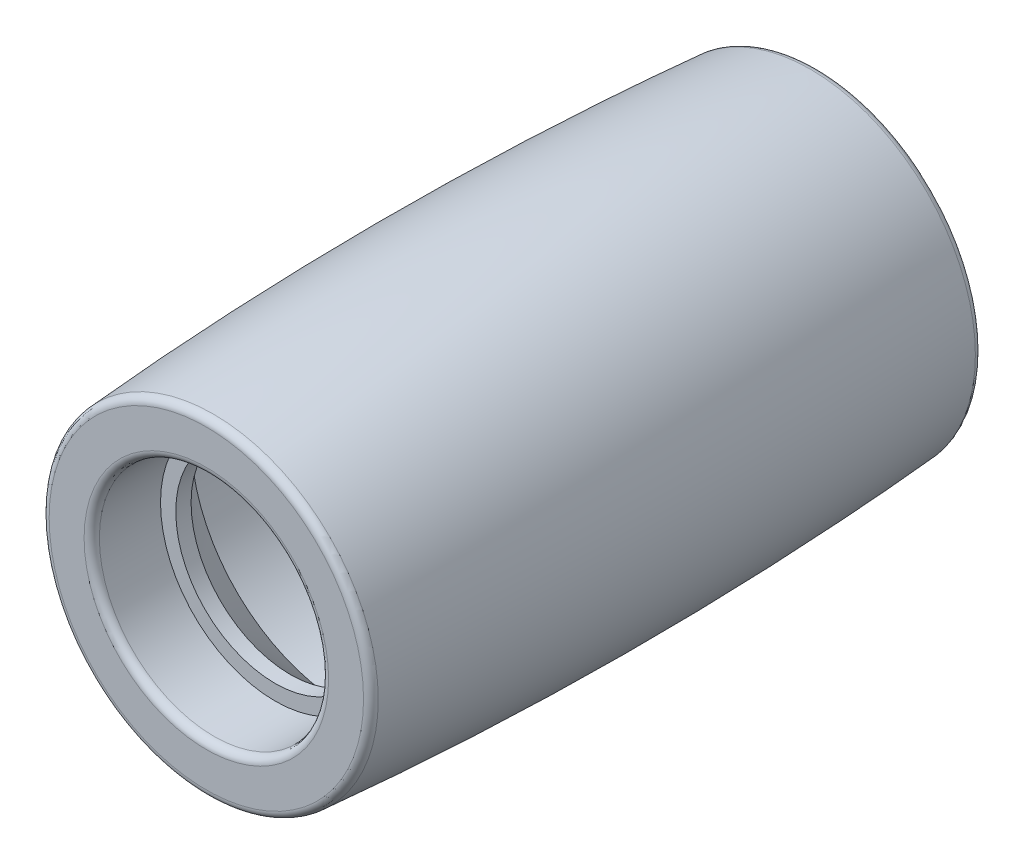
from build123d import *

# Parameters (mm, degrees)
VERRUNDUNG1_R = 1


with BuildPart() as part:
    # Skizze1 → Rotation1 (revolve)
    with BuildSketch(Plane(origin=(450, 0, 0), x_dir=(0, 0, -1), z_dir=(1, 0, 0)), mode=Mode.PRIVATE) as rotation1_sk:
        with BuildLine():
            Line((27.712088496, 20.212088496), (49.5, 20.212088496))
            Line((49.5, 20.212088496), (49.5, 23))
            ThreePointArc((49.5, 23), (29.48594244, 22.624868257), (9.5, 21.5))
            Line((9.5, 21.5), (9.5, 15))
            Line((9.5, 15), (18.5, 15))
            Line((18.5, 15), (18.5, 13))
            Line((18.5, 13), (20.5, 13))
            Line((20.5, 13), (27.712088496, 20.212088496))
        make_face()
    revolve(rotation1_sk.sketch.rotate(Axis((450, 0, 0), (0, 0, -1)), 90), axis=Axis((450, 0, 0), (0, 0, -1)))

    # Spiegeln1: part across plane


with BuildPart() as part_1:
    add(part.part)
    add(part.part.mirror(Plane(origin=(450, 23, -49.5), x_dir=(1, 0, 0), z_dir=(0, 0, 1))))

    # Verrundung1
    verrundung1_edges = [part_1.edges().sort_by_distance(p)[0] for p in [
        (428.5, 0, -89.5),
        (435, 0, -89.5),
        (435, 0, -9.5),
        (428.5, 0, -9.5),
    ]]
    fillet(verrundung1_edges, radius=VERRUNDUNG1_R)


solid = part_1.part
